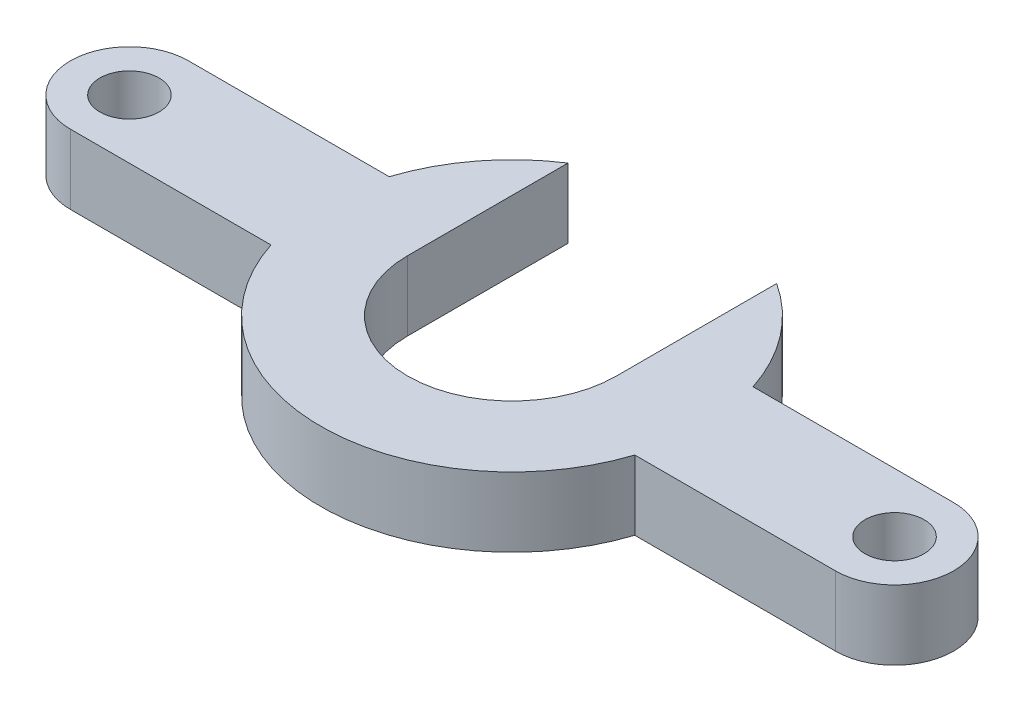
from build123d import *

# Parameters (mm, degrees)
SKETCH1_R           = 4.25
BOSS_EXTRUDE1_DEPTH = 10


with BuildPart() as part:
    # Sketch1 → Boss-Extrude1 (new body)
    with BuildSketch(Plane(origin=(0, 0, 0), x_dir=(1, 0, 0), z_dir=(0, 1, 0))):
        with BuildLine():
            Line((55, 8.5), (26.153393661, 8.5))
            ThreePointArc((26.153393661, 8.5), (21.824706014, 16.731174717), (15, 23.048861143))
            Line((15, 23.048861143), (15, 0))
            ThreePointArc((15, 0), (0, -15), (-15, 0))
            Line((-15, 0), (-15, 23.048861143))
            ThreePointArc((-15, 23.048861143), (-21.824706014, 16.731174717), (-26.153393661, 8.5))
            Line((-26.153393661, 8.5), (-55, 8.5))
            ThreePointArc((-55, 8.5), (-63.5, 0), (-55, -8.5))
            Line((-55, -8.5), (-26.153393661, -8.5))
            ThreePointArc((-26.153393661, -8.5), (0, -27.5), (26.153393661, -8.5))
            Line((26.153393661, -8.5), (55, -8.5))
            ThreePointArc((55, -8.5), (63.5, 0), (55, 8.5))
        make_face()
        with Locations(Location((-55, 0, 0), (0, 0, 270))):
            Circle(SKETCH1_R, mode=Mode.SUBTRACT)
        with Locations(Location((55, 0, 0), (0, 0, 270))):
            Circle(SKETCH1_R, mode=Mode.SUBTRACT)
    extrude(amount=BOSS_EXTRUDE1_DEPTH)


solid = part.part
